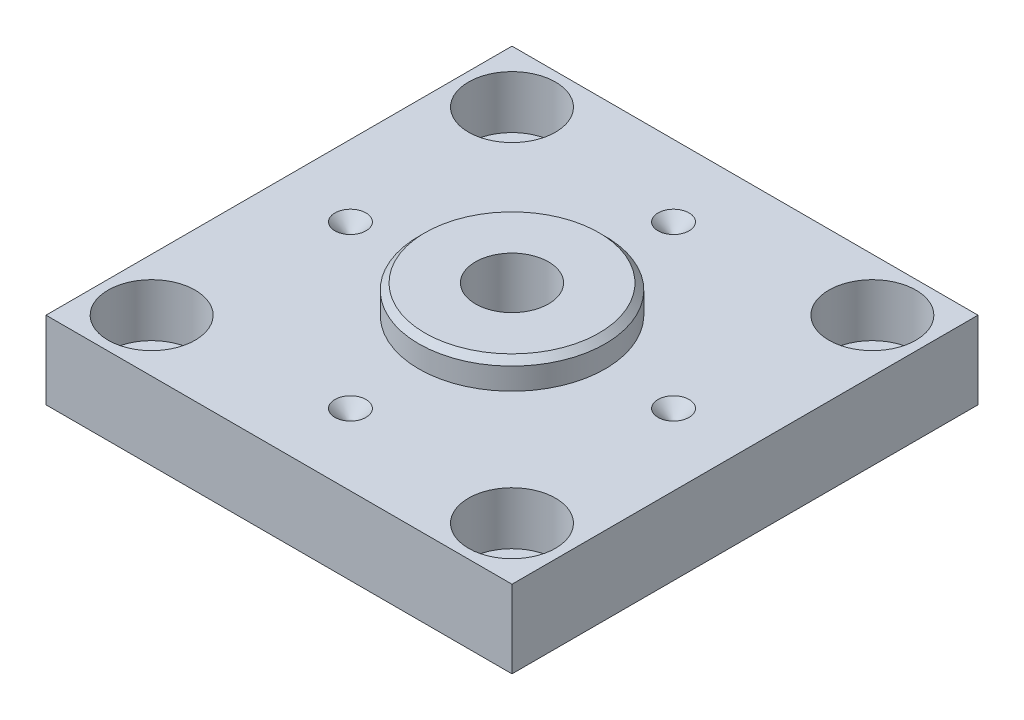
from build123d import *

# Parameters (mm, degrees)
SKETCH2_W              = 150
SKETCH2_H              = 150
BOSS_EXTRUDE1_DEPTH    = 25
SKETCH3_R              = 30
BOSS_EXTRUDE2_DEPTH    = 9
CHAMFER1_SIZE          = 2
HOLE1_D                = 17
HOLE1_CBORE_D          = 28
HOLE1_CBORE_DEPTH      = 17
M25X1_5_TAPPED_HOLE1_D = 23.5
CIRPATTERN1_COUNT      = 4


with BuildPart() as part:
    # Sketch2 → Boss-Extrude1 (new body)
    with BuildSketch(Plane(origin=(0, 0, 0), x_dir=(1, 0, 0), z_dir=(0, 1, 0))):
        Rectangle(SKETCH2_W, SKETCH2_H)
    extrude(amount=BOSS_EXTRUDE1_DEPTH)

    # Sketch3 → Boss-Extrude2 (add)
    with BuildSketch(Plane(origin=(0, 25, 0), x_dir=(1, 0, 0), z_dir=(0, 1, 0))):
        with Locations(Location((0, 0, 0), (0, 0, 270))):
            Circle(SKETCH3_R)
    extrude(amount=BOSS_EXTRUDE2_DEPTH)

    # Chamfer1
    chamfer1_edges = [part.edges().sort_by_distance(p)[0] for p in [
        (0, 34, -30),
    ]]
    chamfer(chamfer1_edges, length=CHAMFER1_SIZE)

    # Hole1 (through all)
    with Locations(Plane(origin=(0, 25, 0), x_dir=(1, 0, 0), z_dir=(0, 1, 0))):
        with Locations((-58, 58), (58, 58), (58, -58), (-58, -58)):
            CounterBoreHole(HOLE1_D / 2, HOLE1_CBORE_D / 2, HOLE1_CBORE_DEPTH)

    # Sketch13 → Cut-Revolve1 (revolve, cut)
    with BuildSketch(Plane.XY):
        Polygon((-57, 25), (-52, 20), (-52, 25), align=None)
    cut_revolve1 = revolve(axis=Axis((-52, 20, 0), (0, 1, 0)), mode=Mode.SUBTRACT)

    # M25x1.5 Tapped Hole1 (through all)
    with Locations(Plane.ZX.offset(34)):
        with Locations((0, 0)):
            Hole(M25X1_5_TAPPED_HOLE1_D / 2)

    # CirPattern1: Cut-Revolve1 ×4 about axis
    cirpattern1_axis = Axis((0, 0, 0), (0, 1, 0))
    for i in range(1, CIRPATTERN1_COUNT):
        add(cut_revolve1.rotate(cirpattern1_axis, i * 360 / CIRPATTERN1_COUNT), mode=Mode.SUBTRACT)


solid = part.part
